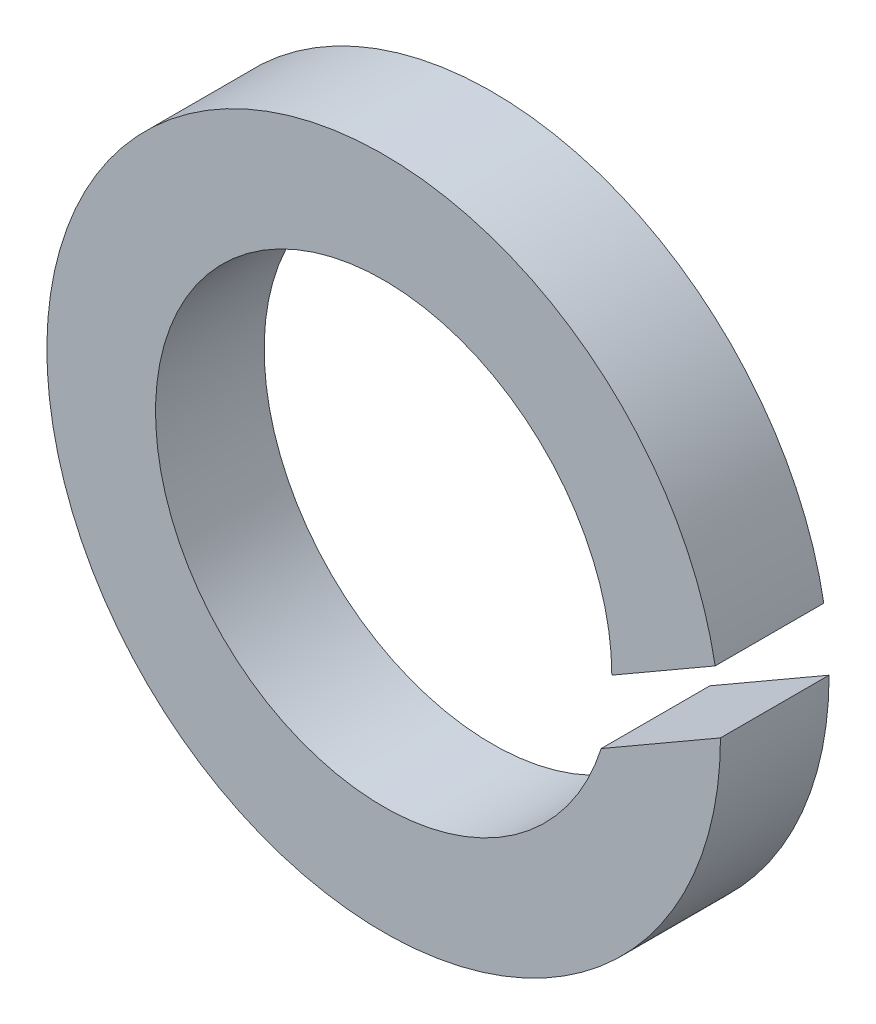
from build123d import *

# Parameters (mm, degrees)
EXTRUDE_242_DEPTH = 0.5


with BuildPart() as part:
    # Эскиз1 → Extrude 242 (new body)
    with BuildSketch(Plane.XY):
        with BuildLine():
            Line((1.05, 0), (1.525494952, 0.274527139))
            ThreePointArc((1.525494952, 0.274527139), (-1.543861583, -0.137809331), (1.55, 0))
            Line((1.55, 0), (1.00101956, -0.316954005))
            ThreePointArc((1.00101956, -0.316954005), (-1.037682644, 0.160358134), (1.05, 0))
        make_face()
    extrude(amount=EXTRUDE_242_DEPTH)


solid = part.part
